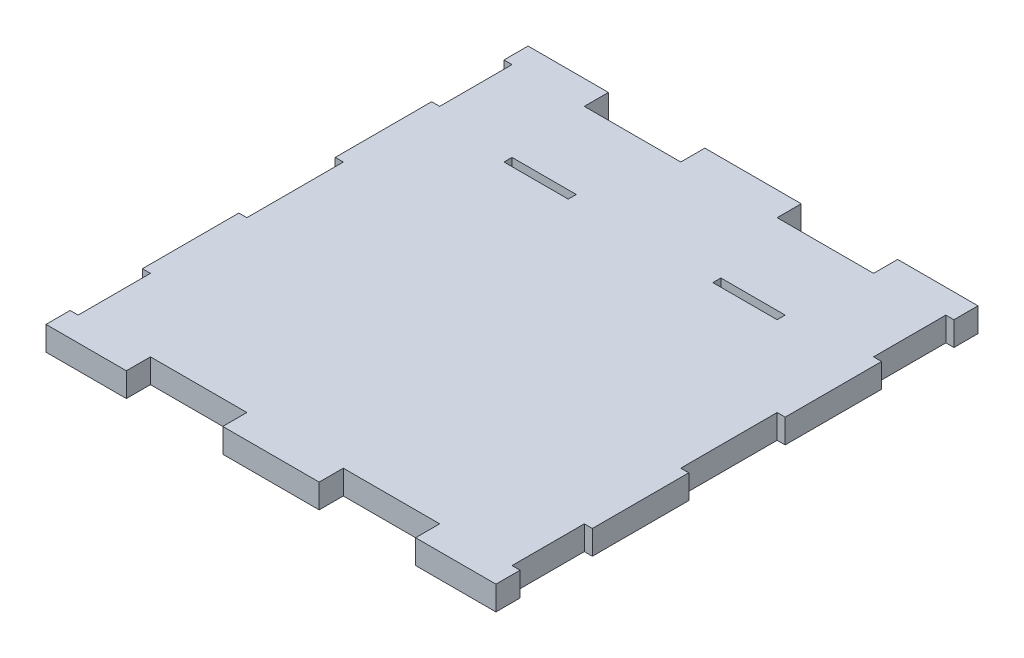
from build123d import *

# Parameters (mm, degrees)
SKETCH1_W           = 190.5
SKETCH1_H           = 190.5
BOSS_EXTRUDE1_DEPTH = 9.525
SKETCH2_W           = 38.1
SKETCH2_H           = 9.525
CUT_EXTRUDE1_DEPTH  = 9.525
SKETCH3_W           = 38.1
SKETCH3_H           = 9.525
CUT_EXTRUDE2_DEPTH  = 9.525
SKETCH4_W           = 9.525
SKETCH4_H           = 28.575
CUT_EXTRUDE3_DEPTH  = 9.525
SKETCH5_W           = 9.525
SKETCH5_H           = 38.1
CUT_EXTRUDE4_DEPTH  = 9.525
SKETCH6_W           = 9.525
SKETCH6_H           = 28.575
CUT_EXTRUDE5_DEPTH  = 9.525
SKETCH7_W           = 38.1
SKETCH7_H           = 9.525
CUT_EXTRUDE6_DEPTH  = 9.525
SKETCH8_W           = 38.1
SKETCH8_H           = 9.525
CUT_EXTRUDE7_DEPTH  = 9.525
SKETCH9_W           = 9.525
SKETCH9_H           = 28.575
CUT_EXTRUDE8_DEPTH  = 38.1
SKETCH10_W          = 9.525
SKETCH10_H          = 38.1
CUT_EXTRUDE9_DEPTH  = 9.525
SKETCH11_W          = 9.525
SKETCH11_H          = 28.575
CUT_EXTRUDE10_DEPTH = 9.525
SKETCH12_W          = 25.4
SKETCH12_H          = 3.175
CUT_EXTRUDE11_DEPTH = 12.7
SKETCH15_W          = 6.35
SKETCH15_H          = 9.525
CUT_EXTRUDE14_DEPTH = 214.194785552
SKETCH19_W          = 6.35
SKETCH19_H          = 38.1
SKETCH19_H_2        = 9.525
CUT_EXTRUDE16_DEPTH = 214.194785552
SKETCH16_W          = 6.35
SKETCH16_H          = 38.1
SKETCH16_H_2        = 9.525
CUT_EXTRUDE15_DEPTH = 209.566482942


with BuildPart() as part:
    # Sketch1 → Boss-Extrude1 (new body)
    with BuildSketch(Plane(origin=(0, 0, 0), x_dir=(1, 0, 0), z_dir=(0, 1, 0))):
        with Locations((61.628840928, 48.799714441)):
            Rectangle(SKETCH1_W, SKETCH1_H)
    extrude(amount=BOSS_EXTRUDE1_DEPTH)

    # Sketch2 → Cut-Extrude1 (cut)
    with BuildSketch(Plane(origin=(0, 9.525, 0), x_dir=(1, 0, 0), z_dir=(0, 1, 0))):
        with Locations((99.728840928, -41.687785559)):
            Rectangle(SKETCH2_W, SKETCH2_H)
    extrude(amount=-CUT_EXTRUDE1_DEPTH, mode=Mode.SUBTRACT)

    # Sketch3 → Cut-Extrude2 (cut)
    with BuildSketch(Plane(origin=(0, 9.525, 0), x_dir=(1, 0, 0), z_dir=(0, 1, 0))):
        with Locations((23.528840928, -41.687785559)):
            Rectangle(SKETCH3_W, SKETCH3_H)
    extrude(amount=-CUT_EXTRUDE2_DEPTH, mode=Mode.SUBTRACT)

    # Sketch4 → Cut-Extrude3 (cut)
    with BuildSketch(Plane(origin=(0, 9.525, 0), x_dir=(1, 0, 0), z_dir=(0, 1, 0))):
        with Locations((152.116340928, -22.637785559)):
            Rectangle(SKETCH4_W, SKETCH4_H)
    extrude(amount=-CUT_EXTRUDE3_DEPTH, mode=Mode.SUBTRACT)

    # Sketch5 → Cut-Extrude4 (cut)
    with BuildSketch(Plane(origin=(0, 9.525, 0), x_dir=(1, 0, 0), z_dir=(0, 1, 0))):
        with Locations((152.116340928, 48.799714441)):
            Rectangle(SKETCH5_W, SKETCH5_H)
    extrude(amount=-CUT_EXTRUDE4_DEPTH, mode=Mode.SUBTRACT)

    # Sketch6 → Cut-Extrude5 (cut)
    with BuildSketch(Plane(origin=(0, 9.525, 0), x_dir=(1, 0, 0), z_dir=(0, 1, 0))):
        with Locations((152.116340928, 120.237214441)):
            Rectangle(SKETCH6_W, SKETCH6_H)
    extrude(amount=-CUT_EXTRUDE5_DEPTH, mode=Mode.SUBTRACT)

    # Sketch7 → Cut-Extrude6 (cut)
    with BuildSketch(Plane(origin=(0, 9.525, 0), x_dir=(1, 0, 0), z_dir=(0, 1, 0))):
        with Locations((99.728840928, 139.287214441)):
            Rectangle(SKETCH7_W, SKETCH7_H)
    extrude(amount=-CUT_EXTRUDE6_DEPTH, mode=Mode.SUBTRACT)

    # Sketch8 → Cut-Extrude7 (cut)
    with BuildSketch(Plane(origin=(0, 9.525, 0), x_dir=(1, 0, 0), z_dir=(0, 1, 0))):
        with Locations((23.528840928, 139.287214441)):
            Rectangle(SKETCH8_W, SKETCH8_H)
    extrude(amount=-CUT_EXTRUDE7_DEPTH, mode=Mode.SUBTRACT)

    # Sketch9 → Cut-Extrude8 (cut)
    with BuildSketch(Plane(origin=(0, 9.525, 0), x_dir=(1, 0, 0), z_dir=(0, 1, 0))):
        with Locations((-28.858659072, 120.237214441)):
            Rectangle(SKETCH9_W, SKETCH9_H)
    extrude(amount=-CUT_EXTRUDE8_DEPTH, mode=Mode.SUBTRACT)

    # Sketch10 → Cut-Extrude9 (cut)
    with BuildSketch(Plane(origin=(0, 9.525, 0), x_dir=(1, 0, 0), z_dir=(0, 1, 0))):
        with Locations((-28.858659072, 48.799714441)):
            Rectangle(SKETCH10_W, SKETCH10_H)
    extrude(amount=-CUT_EXTRUDE9_DEPTH, mode=Mode.SUBTRACT)

    # Sketch11 → Cut-Extrude10 (cut)
    with BuildSketch(Plane(origin=(0, 9.525, 0), x_dir=(1, 0, 0), z_dir=(0, 1, 0))):
        with Locations((-28.858659072, -22.637785559)):
            Rectangle(SKETCH11_W, SKETCH11_H)
    extrude(amount=-CUT_EXTRUDE10_DEPTH, mode=Mode.SUBTRACT)

    # Sketch12 → Cut-Extrude11 (cut)
    with BuildSketch(Plane(origin=(0, 9.525, 0), x_dir=(1, 0, 0), z_dir=(0, 1, 0))):
        with Locations((20.353840928, 101.187214441)):
            Rectangle(SKETCH12_W, SKETCH12_H)
        with Locations((102.903840928, 101.187214441)):
            Rectangle(SKETCH12_W, SKETCH12_H)
    extrude(amount=-CUT_EXTRUDE11_DEPTH, mode=Mode.SUBTRACT)

    # Sketch15 → Cut-Extrude14 (cut, through all)
    with BuildSketch(Plane(origin=(0, 9.525, 0), x_dir=(1, 0, 0), z_dir=(0, 1, 0))):
        with Locations((-30.446159072, 139.287214441)):
            Rectangle(SKETCH15_W, SKETCH15_H)
    extrude(amount=-CUT_EXTRUDE14_DEPTH, mode=Mode.SUBTRACT)

    # Sketch19 → Cut-Extrude16 (cut, through all)
    with BuildSketch(Plane(origin=(0, 9.525, 0), x_dir=(1, 0, 0), z_dir=(0, 1, 0))):
        with Locations((-30.446159072, 86.899714441)):
            Rectangle(SKETCH19_W, SKETCH19_H)
        with Locations((-30.446159072, 10.699714441)):
            Rectangle(SKETCH19_W, SKETCH19_H)
        with Locations((-30.446159072, -41.687785559)):
            Rectangle(SKETCH19_W, SKETCH19_H_2)
        with Locations((153.703840928, -41.687785559)):
            Rectangle(SKETCH19_W, SKETCH19_H_2)
        with Locations((153.703840928, 10.699714441)):
            Rectangle(SKETCH19_W, SKETCH19_H)
        with Locations((153.703840928, 86.899714441)):
            Rectangle(SKETCH19_W, SKETCH19_H)
        with Locations((153.703840928, 139.287214441)):
            Rectangle(SKETCH19_W, SKETCH19_H_2)
    extrude(amount=-CUT_EXTRUDE16_DEPTH, mode=Mode.SUBTRACT)

    # Sketch16 → Cut-Extrude15 (cut, through all)
    with BuildSketch(Plane(origin=(0, 9.525, 0), x_dir=(1, 0, 0), z_dir=(0, 1, 0))):
        with Locations((-30.446159072, 86.899714441)):
            Rectangle(SKETCH16_W, SKETCH16_H)
        with Locations((-30.446159072, 10.699714441)):
            Rectangle(SKETCH16_W, SKETCH16_H)
        with Locations((-30.446159072, -41.687785559)):
            Rectangle(SKETCH16_W, SKETCH16_H_2)
        with Locations((153.703840928, -41.687785559)):
            Rectangle(SKETCH16_W, SKETCH16_H_2)
        with Locations((153.703840928, 10.699714441)):
            Rectangle(SKETCH16_W, SKETCH16_H)
        with Locations((153.703840928, 86.899714441)):
            Rectangle(SKETCH16_W, SKETCH16_H)
        with Locations((153.703840928, 139.287214441)):
            Rectangle(SKETCH16_W, SKETCH16_H_2)
    extrude(amount=-CUT_EXTRUDE15_DEPTH, mode=Mode.SUBTRACT)


solid = part.part
